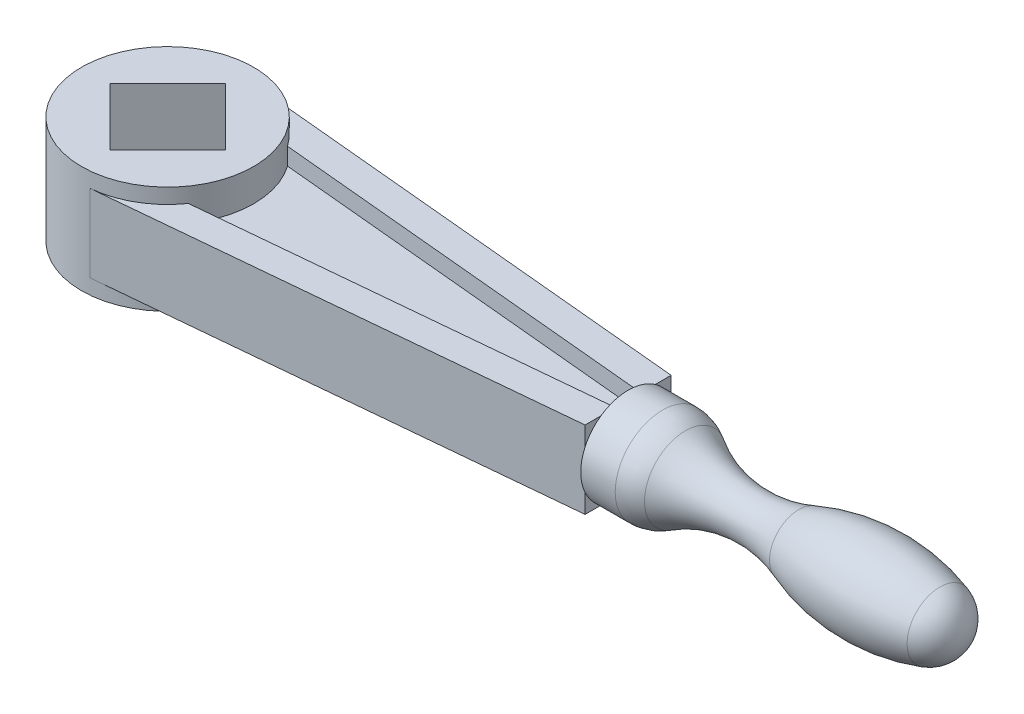
from build123d import *
from build123d.topology import SkipClean

# Parameters (mm, degrees)
SKETCH_1_R          = 20
EXTRUDE_1_DEPTH     = 12.5
EXTRUDE_2_DEPTH     = 9
CUT_EXTRUDE_START   = 5
CUT_EXTRUDE_1_DEPTH = 4
CUT_EXTRUDE_START_2 = -9
CUT_EXTRUDE_2_DEPTH = 4


with BuildPart() as part:
    # 草图1 → 凸台-拉伸1 (new, symmetric)
    with BuildSketch(Plane(origin=(0, 0, 0), x_dir=(1, 0, 0), z_dir=(0, 1, 0))):
        with Locations(Location((0, 0, 0), (0, 0, 270))):
            Circle(SKETCH_1_R)
        Polygon((0, 13.435028843), (13.435028843, 0), (0, -13.435028843), (-13.435028843, 0), align=None, mode=Mode.SUBTRACT)
    extrude(amount=EXTRUDE_1_DEPTH, both=True)

    # 草图2 → 凸台-拉伸2 (add, symmetric)
    with BuildSketch(Plane(origin=(0, 0, 0), x_dir=(1, 0, 0), z_dir=(0, 1, 0))):
        with BuildLine():
            ThreePointArc((1.877412327, 19.911688099), (14.791014951, 13.462016072), (20, 0))
            Line((20, 0), (107, 0))
            Line((107, 0), (107, 10))
            Line((107, 10), (1.877412327, 19.911688099))
        make_face()
        with BuildLine():
            Line((107, 0), (20, 0))
            ThreePointArc((20, 0), (14.791014951, -13.462016072), (1.877412327, -19.911688099))
            Line((1.877412327, -19.911688099), (107, -10))
            Line((107, -10), (107, 0))
        make_face()
    extrude(amount=EXTRUDE_2_DEPTH, both=True)

    # 草图3 → 切除-拉伸1 (cut)
    with SkipClean():  # the faces are left unmerged after this step: merging them gives an invalid solid
        with BuildSketch(Plane(origin=(0, 0, 0), x_dir=(1, 0, 0), z_dir=(0, 1, 0)).offset(CUT_EXTRUDE_START)):
            with BuildLine():
                Line((107, 2.968953747), (16.351890932, 11.515887415))
                ThreePointArc((16.351890932, 11.515887415), (20, 0), (16.351890932, -11.515887415))
                Line((16.351890932, -11.515887415), (107, -2.968953747))
                Line((107, -2.968953747), (107, 2.968953747))
            make_face()
        extrude(amount=CUT_EXTRUDE_1_DEPTH, mode=Mode.SUBTRACT)

    # 草图3<2> → 切除-拉伸2 (cut)
    with SkipClean():  # the faces are left unmerged after this step: merging them gives an invalid solid
        with BuildSketch(Plane(origin=(0, 0, 0), x_dir=(1, 0, 0), z_dir=(0, 1, 0)).offset(CUT_EXTRUDE_START_2)):
            with BuildLine():
                Line((107, 2.968953747), (16.351890932, 11.515887415))
                ThreePointArc((16.351890932, 11.515887415), (20, 0), (16.351890932, -11.515887415))
                Line((16.351890932, -11.515887415), (107, -2.968953747))
                Line((107, -2.968953747), (107, 2.968953747))
            make_face()
        extrude(amount=CUT_EXTRUDE_2_DEPTH, mode=Mode.SUBTRACT)

    # 草图4 → 旋转1 (revolve)
    with SkipClean():  # the faces are left unmerged after this step: merging them gives an invalid solid
        with BuildSketch(Plane(origin=(0, 0, 0), x_dir=(1, 0, 0), z_dir=(0, 1, 0)), mode=Mode.PRIVATE) as revolve_1_sk:
            with BuildLine():
                Line((107, 0), (107, 11))
                Line((107, 11), (115, 11))
                ThreePointArc((115, 11), (117.753651476, 10.613397087), (120.294389016, 9.483480709))
                ThreePointArc((120.294389016, 9.483480709), (133.180287907, 5.08402529), (146.683629362, 6.833701774))
                ThreePointArc((146.683629362, 6.833701774), (162.995301682, 9.985635116), (179.439285424, 7.619047619))
                ThreePointArc((179.439285424, 7.619047619), (183.461976609, 4.716233487), (185, 0))
                Line((185, 0), (107, 0))
            make_face()
        revolve(revolve_1_sk.sketch.rotate(Axis((0, 0, 0), (1, 0, 0)), 180), axis=Axis((0, 0, 0), (1, 0, 0)))


solid = part.part
